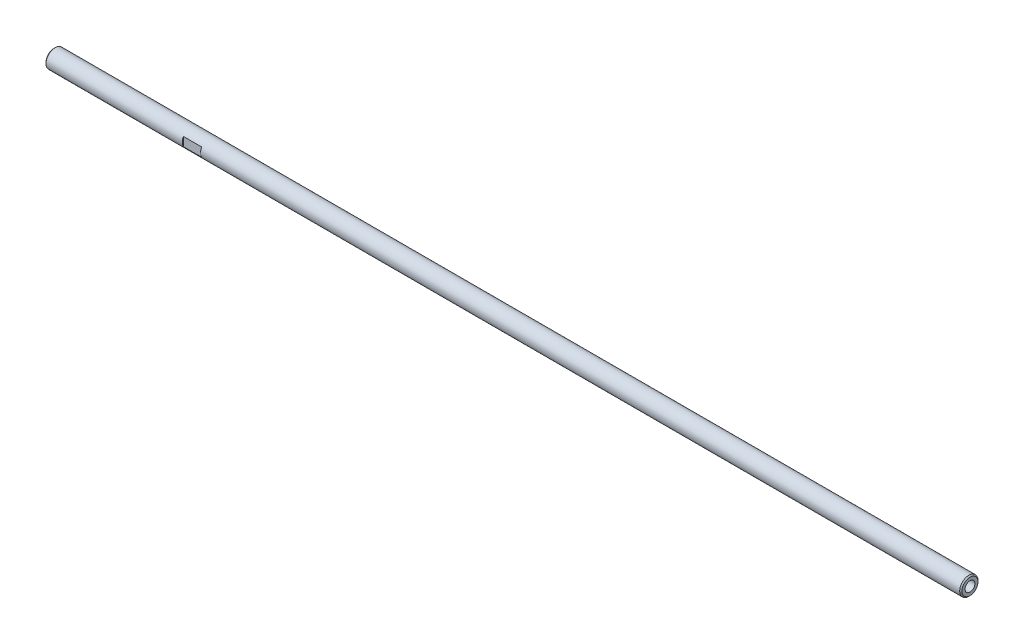
from build123d import *

# Parameters (mm, degrees)
CHAMFER_1_SIZE       = 0.5
SKETCH_2_OUTSIDE_W   = 90.032
SKETCH_2_OUTSIDE_H   = 90.032
SKETCH_2_OUTSIDE_W_2 = 7
SKETCH_2_OUTSIDE_H_2 = 8
CUT_EXTRUDE_1_DEPTH  = 8


with BuildPart() as part:
    # 草图1 → 旋转1 (revolve)
    with BuildSketch(Plane.XY, mode=Mode.PRIVATE) as revolve_1_sk:
        Polygon((-200, 2.15), (-190, 2.15), (-188.708149669, 0), (188.708149669, 0), (190, 2.15), (200, 2.15), (200, 4), (-200, 4), align=None)
    revolve(revolve_1_sk.sketch.rotate(Axis((0, 0, 0), (1, 0, 0)), 90), axis=Axis((0, 0, 0), (1, 0, 0)))

    # 倒角1
    chamfer_1_edges = [part.edges().sort_by_distance(p)[0] for p in [
        (-200, 0, -4),
        (200, 0, -4),
    ]]
    chamfer(chamfer_1_edges, length=CHAMFER_1_SIZE)

    # 草图2 outside → 切除-拉伸1 (cut)
    with BuildSketch(Plane.ZY.offset(140)):
        Rectangle(SKETCH_2_OUTSIDE_W, SKETCH_2_OUTSIDE_H)
        Rectangle(SKETCH_2_OUTSIDE_W_2, SKETCH_2_OUTSIDE_H_2, mode=Mode.SUBTRACT)
    extrude(amount=-CUT_EXTRUDE_1_DEPTH, mode=Mode.SUBTRACT)


solid = part.part
